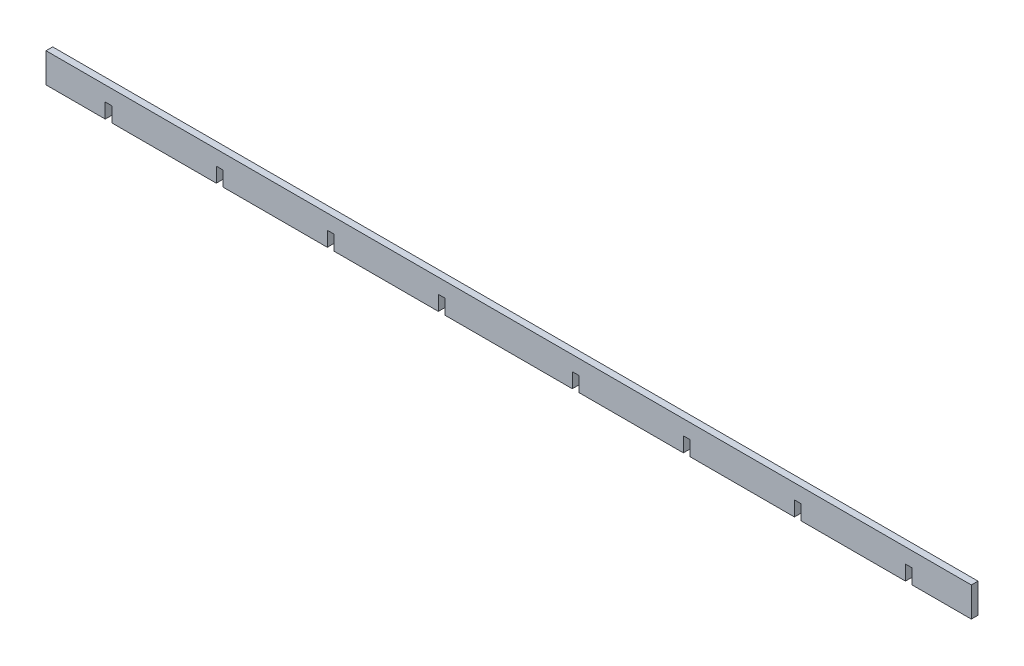
from build123d import *

# Parameters (mm, degrees)
BOSS_EXTRUDE1_DEPTH = 18


with BuildPart() as part:
    # Sketch1 → Boss-Extrude1 (new body)
    with BuildSketch(Plane.XY):
        Polygon((2322, 40), (-178, 40), (-178, -40), (-18, -40), (-18, 0), (0, 0), (0, -40), (282, -40), (282, 0), (300, 0), (300, -40), (582, -40), (582, 0), (600, 0), (600, -40), (882, -40), (882, 0), (900, 0), (900, -40), (1244, -40), (1244, 0), (1262, 0), (1262, -40), (1544, -40), (1544, 0), (1562, 0), (1562, -40), (1844, -40), (1844, 0), (1862, 0), (1862, -40), (2144, -40), (2144, 0), (2162, 0), (2162, -40), (2322, -40), align=None)
    extrude(amount=BOSS_EXTRUDE1_DEPTH)


solid = part.part
